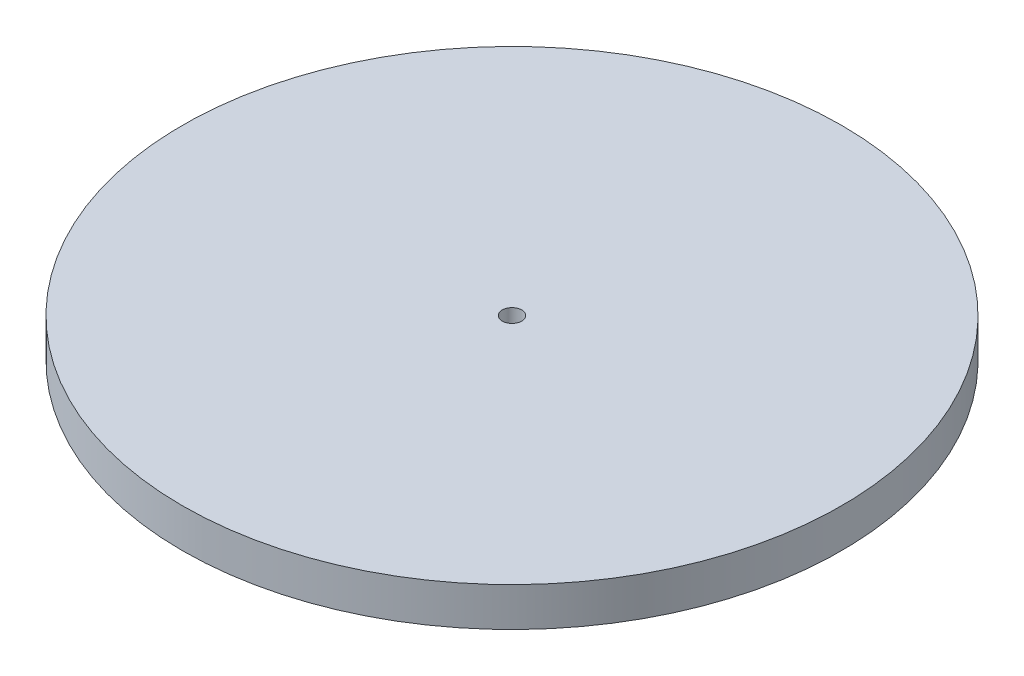
from build123d import *

# Parameters (mm, degrees)
SKETCH1_R           = 25.4
BOSS_EXTRUDE1_DEPTH = 1.5
SKETCH2_R           = 0.75
CUT_EXTRUDE1_DEPTH  = 37.046081618


with BuildPart() as part:
    # Sketch1 → Boss-Extrude1 (new, symmetric)
    with BuildSketch(Plane(origin=(0, 0, 0), x_dir=(1, 0, 0), z_dir=(0, 1, 0))):
        with Locations(Location((0, 0, 0), (0, 0, 270))):
            Circle(SKETCH1_R)
    extrude(amount=BOSS_EXTRUDE1_DEPTH, both=True)

    # Sketch2 → Cut-Extrude1 (cut, through all)
    with BuildSketch(Plane(origin=(0, 1.5, 0), x_dir=(1, 0, 0), z_dir=(0, 1, 0))):
        with Locations(Location((0, 0, 0), (0, 0, 270))):
            Circle(SKETCH2_R)
    extrude(amount=-CUT_EXTRUDE1_DEPTH, mode=Mode.SUBTRACT)


solid = part.part
